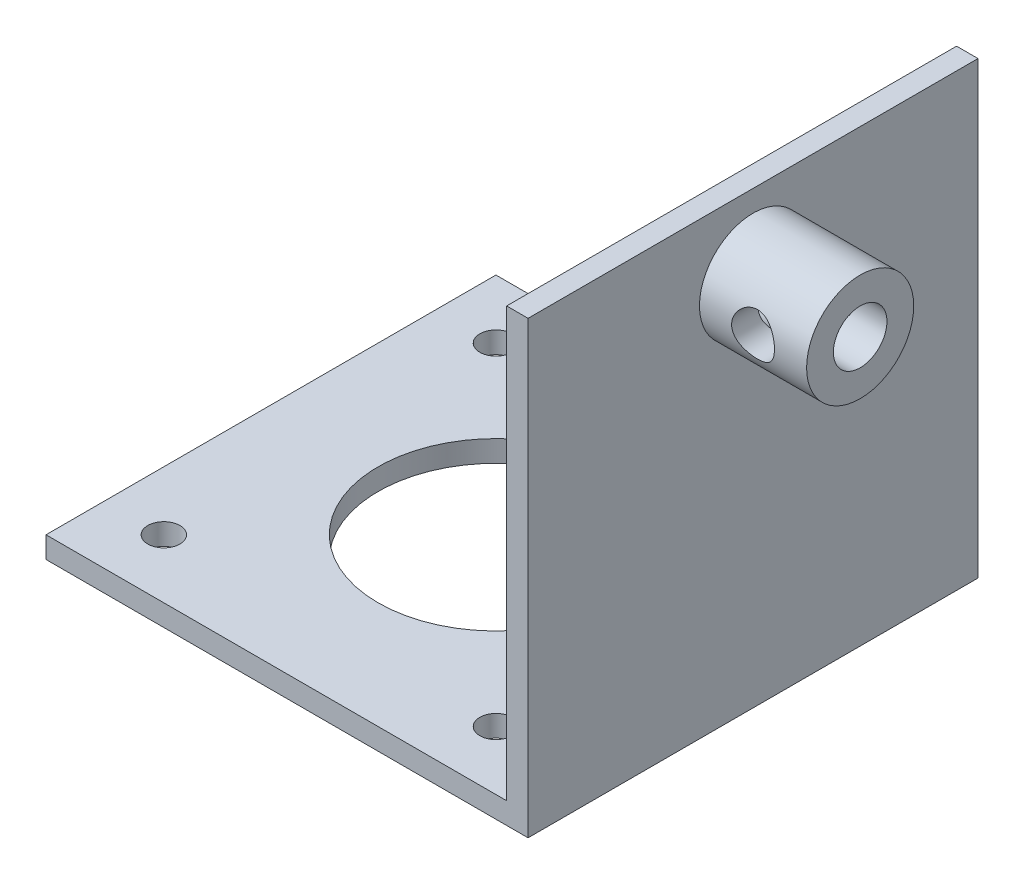
from build123d import *

# Parameters (mm, degrees)
SKETCH_1_W          = 45
SKETCH_1_H          = 42
EXTRUDE_1_DEPTH     = 2
SKETCH_2_R          = 11
SKETCH_2_R_2        = 1.5
CUT_EXTRUDE_1_DEPTH = 2
SKETCH_3_W          = 2
SKETCH_3_H          = 42
EXTRUDE_2_DEPTH     = 40
SKETCH_4_R          = 5
SKETCH_4_R_2        = 2.5
EXTRUDE_3_DEPTH     = 10
SKETCH_5_R          = 2
CUT_EXTRUDE_2_DEPTH = 81.950602221


with BuildPart() as part:
    # 草图1 → 凸台-拉伸1 (new body)
    with BuildSketch(Plane(origin=(0, 0, 0), x_dir=(1, 0, 0), z_dir=(0, 1, 0))):
        with Locations((22.5, 21)):
            Rectangle(SKETCH_1_W, SKETCH_1_H)
    extrude(amount=EXTRUDE_1_DEPTH)

    # 草图2 → 切除-拉伸1 (cut)
    with BuildSketch(Plane(origin=(0, 2, 0), x_dir=(1, 0, 0), z_dir=(0, 1, 0))):
        with Locations(Location((21, 21, 0), (0, 0, 270))):
            Circle(SKETCH_2_R)
        with Locations(Location((5.5, 5.5, 0), (0, 0, 270))):
            Circle(SKETCH_2_R_2)
        with Locations(Location((5.5, 36.5, 0), (0, 0, 270))):
            Circle(SKETCH_2_R_2)
        with Locations(Location((36.5, 36.5, 0), (0, 0, 270))):
            Circle(SKETCH_2_R_2)
        with Locations(Location((36.5, 5.5, 0), (0, 0, 270))):
            Circle(SKETCH_2_R_2)
    extrude(amount=-CUT_EXTRUDE_1_DEPTH, mode=Mode.SUBTRACT)

    # 草图3 → 凸台-拉伸2 (add)
    with BuildSketch(Plane(origin=(0, 2, 0), x_dir=(1, 0, 0), z_dir=(0, 1, 0))):
        with Locations((44, 21)):
            Rectangle(SKETCH_3_W, SKETCH_3_H)
    extrude(amount=EXTRUDE_2_DEPTH)

    # 草图4 → 凸台-拉伸3 (add)
    with BuildSketch(Plane(origin=(45, 0, 0), x_dir=(0, 0, -1), z_dir=(1, 0, 0))):
        with Locations(Location((21, 35, 0), (0, 0, 180))):
            Circle(SKETCH_4_R)
        with Locations((21, 35)):
            Circle(SKETCH_4_R_2, mode=Mode.SUBTRACT)
    extrude(amount=EXTRUDE_3_DEPTH)

    # 草图5 → 切除-拉伸2 (cut, through all)
    with BuildSketch(Plane.XY):
        with Locations((50, 35)):
            Circle(SKETCH_5_R)
    extrude(amount=-CUT_EXTRUDE_2_DEPTH, mode=Mode.SUBTRACT)


solid = part.part
